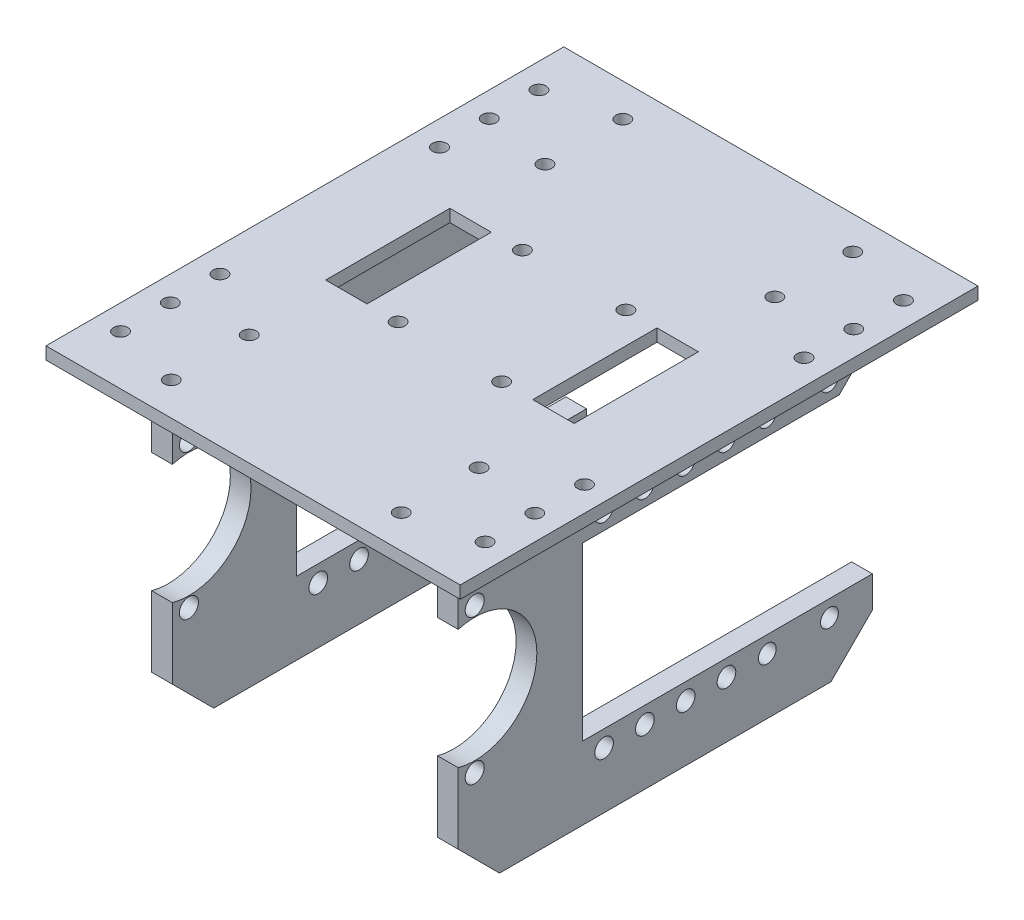
from build123d import *

# Parameters (mm, degrees)
SKETCH_1_W           = 100
SKETCH_1_H           = 125
EXTRUDE_1_DEPTH      = 3
SKETCH_2_W           = 5
SKETCH_2_H           = 100
EXTRUDE_2_DEPTH      = 75
SKETCH_3_R           = 2.25
CUT_EXTRUDE_1_DEPTH  = 85
SKETCH_4_W           = 40
SKETCH_4_H           = 41.42
CUT_EXTRUDE_2_DEPTH  = 85
CHAMFER_1_SIZE       = 10
SKETCH_5_W           = 10
SKETCH_5_H           = 30
CUT_EXTRUDE_3_DEPTH  = 85
SKETCH_11_R          = 1.7
CUT_EXTRUDE_5_DEPTH  = 10
SKETCH_12_R          = 1.7
CUT_EXTRUDE_6_DEPTH  = 25
SKETCH_13_R          = 2.3
SKETCH_13_R_2        = 15
CUT_EXTRUDE_9_DEPTH  = 105
SKETCH_14_W          = 15
SKETCH_14_H          = 41.42
CUT_EXTRUDE_10_DEPTH = 83
SKETCH_15_W          = 38.97610678
SKETCH_15_H          = 41.42
CUT_EXTRUDE_11_DEPTH = 83
SKETCH_16_R          = 1.7
CUT_EXTRUDE_12_DEPTH = 83
SKETCH_17_R          = 2.15
CUT_EXTRUDE_13_DEPTH = 83
CHAMFER_2_SIZE       = 8


with BuildPart() as part:
    # 草图1 → 凸台-拉伸1 (new body)
    with BuildSketch(Plane(origin=(0, 0, 0), x_dir=(1, 0, 0), z_dir=(0, 1, 0))):
        Rectangle(SKETCH_1_W, SKETCH_1_H)
    extrude(amount=EXTRUDE_1_DEPTH)

    # 草图2 → 凸台-拉伸2 (add)
    with BuildSketch(Plane.XZ):
        with Locations((-34.5, 0)):
            Rectangle(SKETCH_2_W, SKETCH_2_H)
        with Locations((34.5, 0)):
            Rectangle(SKETCH_2_W, SKETCH_2_H)
    extrude(amount=EXTRUDE_2_DEPTH)

    # 草图3 → 切除-拉伸1 (cut)
    with BuildSketch(Plane.ZY.offset(37)):
        with Locations((-4.925, -12)):
            Circle(SKETCH_3_R)
        with Locations((4.925, -12)):
            Circle(SKETCH_3_R)
        with Locations((-4.925, -61.42)):
            Circle(SKETCH_3_R)
        with Locations((4.925, -61.42)):
            Circle(SKETCH_3_R)
        with Locations((14.775, -12)):
            Circle(SKETCH_3_R)
        with Locations((14.775, -61.42)):
            Circle(SKETCH_3_R)
        with Locations((-14.775, -61.42)):
            Circle(SKETCH_3_R)
        with Locations((-14.775, -12)):
            Circle(SKETCH_3_R)
    extrude(amount=-CUT_EXTRUDE_1_DEPTH, mode=Mode.SUBTRACT)

    # 草图4 → 切除-拉伸2 (cut)
    with BuildSketch(Plane.ZY.offset(37)):
        with Locations((0, -36.71)):
            Rectangle(SKETCH_4_W, SKETCH_4_H)
    extrude(amount=-CUT_EXTRUDE_2_DEPTH, mode=Mode.SUBTRACT)

    # 倒角1
    chamfer_1_edges = [part.edges().sort_by_distance(p)[0] for p in [
        (-34.5, -75, 50),
        (-34.5, -75, -50),
        (34.5, -75, 50),
        (34.5, -75, -50),
    ]]
    chamfer(chamfer_1_edges, length=CHAMFER_1_SIZE)

    # 草图5 → 切除-拉伸3 (cut)
    with BuildSketch(Plane(origin=(0, 3, 0), x_dir=(1, 0, 0), z_dir=(0, 1, 0))):
        with Locations((-25, 0)):
            Rectangle(SKETCH_5_W, SKETCH_5_H)
        with Locations((25, 0)):
            Rectangle(SKETCH_5_W, SKETCH_5_H)
    extrude(amount=-CUT_EXTRUDE_3_DEPTH, mode=Mode.SUBTRACT)

    # 草图11 → 切除-拉伸5 (cut)
    with BuildSketch(Plane.XZ):
        with Locations(Location((-44, 50.5, 0), (0, 0, 270))):
            Circle(SKETCH_11_R)
        with Locations(Location((-44, 38.5, 0), (0, 0, 270))):
            Circle(SKETCH_11_R)
        with Locations(Location((-44, 26.5, 0), (0, 0, 270))):
            Circle(SKETCH_11_R)
        with Locations(Location((44, 26.5, 0), (0, 0, 270))):
            Circle(SKETCH_11_R)
        with Locations(Location((44, 38.5, 0), (0, 0, 270))):
            Circle(SKETCH_11_R)
        with Locations(Location((44, 50.5, 0), (0, 0, 270))):
            Circle(SKETCH_11_R)
        with Locations(Location((44, -50.5, 0), (0, 0, 270))):
            Circle(SKETCH_11_R)
        with Locations(Location((44, -38.5, 0), (0, 0, 270))):
            Circle(SKETCH_11_R)
        with Locations(Location((44, -26.5, 0), (0, 0, 270))):
            Circle(SKETCH_11_R)
        with Locations(Location((-44, -26.5, 0), (0, 0, 270))):
            Circle(SKETCH_11_R)
        with Locations(Location((-44, -38.5, 0), (0, 0, 270))):
            Circle(SKETCH_11_R)
        with Locations(Location((-44, -50.5, 0), (0, 0, 270))):
            Circle(SKETCH_11_R)
    extrude(amount=-CUT_EXTRUDE_5_DEPTH, mode=Mode.SUBTRACT)

    # 草图12 → 切除-拉伸6 (cut)
    with BuildSketch(Plane(origin=(0, 3, 0), x_dir=(1, 0, 0), z_dir=(0, 1, 0))):
        with Locations(Location((-27.75, 54.5, 0), (0, 0, 270))):
            Circle(SKETCH_12_R)
        with Locations(Location((-27.75, 35.7, 0), (0, 0, 270))):
            Circle(SKETCH_12_R)
        with Locations(Location((27.75, 35.7, 0), (0, 0, 90))):
            Circle(SKETCH_12_R)
        with Locations(Location((27.75, 54.5, 0), (0, 0, 90))):
            Circle(SKETCH_12_R)
        with Locations(Location((27.75, -54.5, 0), (0, 0, 270))):
            Circle(SKETCH_12_R)
        with Locations(Location((27.75, -35.7, 0), (0, 0, 270))):
            Circle(SKETCH_12_R)
        with Locations(Location((-27.75, -35.7, 0), (0, 0, 90))):
            Circle(SKETCH_12_R)
        with Locations(Location((-27.75, -54.5, 0), (0, 0, 90))):
            Circle(SKETCH_12_R)
    extrude(amount=-CUT_EXTRUDE_6_DEPTH, mode=Mode.SUBTRACT)

    # 草图13 → 切除-拉伸9 (cut)
    with BuildSketch(Plane.ZY.offset(37)):
        with Locations((46, -16)):
            Circle(SKETCH_13_R)
        with Locations((46, -51)):
            Circle(SKETCH_13_R)
        with Locations((46, -33.5)):
            Circle(SKETCH_13_R_2)
    extrude(amount=-CUT_EXTRUDE_9_DEPTH, mode=Mode.SUBTRACT)

    # 草图14 → 切除-拉伸10 (cut)
    with BuildSketch(Plane.ZY.offset(37)):
        with Locations((-27.5, -36.71)):
            Rectangle(SKETCH_14_W, SKETCH_14_H)
    extrude(amount=-CUT_EXTRUDE_10_DEPTH, mode=Mode.SUBTRACT)

    # 草图15 → 切除-拉伸11 (cut)
    with BuildSketch(Plane.ZY.offset(37)):
        with Locations((-35, -36.71)):
            Rectangle(SKETCH_15_W, SKETCH_15_H)
    extrude(amount=-CUT_EXTRUDE_11_DEPTH, mode=Mode.SUBTRACT)

    # 草图16 → 切除-拉伸12 (cut)
    with BuildSketch(Plane(origin=(0, 3, 0), x_dir=(1, 0, 0), z_dir=(0, 1, 0))):
        with Locations(Location((-12.5, 15, 0), (0, 0, 270))):
            Circle(SKETCH_16_R)
        with Locations(Location((12.5, 15, 0), (0, 0, 90))):
            Circle(SKETCH_16_R)
        with Locations(Location((12.5, -15, 0), (0, 0, 270))):
            Circle(SKETCH_16_R)
        with Locations(Location((-12.5, -15, 0), (0, 0, 90))):
            Circle(SKETCH_16_R)
    extrude(amount=-CUT_EXTRUDE_12_DEPTH, mode=Mode.SUBTRACT)

    # 草图17 → 切除-拉伸13 (cut)
    with BuildSketch(Plane.ZY.offset(37)):
        with Locations((-24.625, -12)):
            Circle(SKETCH_17_R)
        with Locations((-24.625, -61.42)):
            Circle(SKETCH_17_R)
        with Locations((-39.625, -12)):
            Circle(SKETCH_17_R)
        with Locations((-39.625, -61.42)):
            Circle(SKETCH_17_R)
    extrude(amount=-CUT_EXTRUDE_13_DEPTH, mode=Mode.SUBTRACT)

    # 倒角2
    chamfer_2_edges = [part.edges().sort_by_distance(p)[0] for p in [
        (34.5, -16, -50),
        (-34.5, -16, -50),
    ]]
    chamfer(chamfer_2_edges, length=CHAMFER_2_SIZE)


solid = part.part
